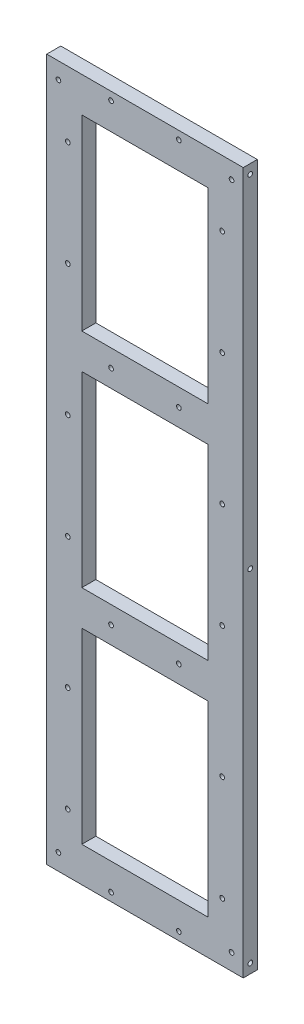
from build123d import *

# Parameters (mm, degrees)
SKETCH1_W           = 84
SKETCH1_H           = 300
SKETCH1_W_2         = 54
SKETCH1_H_2         = 80
BOSS_EXTRUDE1_DEPTH = 6
SKETCH2_R           = 1
CUT_EXTRUDE1_DEPTH  = 10
SKETCH4_R           = 1
CUT_EXTRUDE3_DEPTH  = 10
SKETCH5_R           = 1
CUT_EXTRUDE4_DEPTH  = 10


with BuildPart() as part:
    # Sketch1 → Boss-Extrude1 (new body)
    with BuildSketch(Plane.XY):
        Rectangle(SKETCH1_W, SKETCH1_H)
        with Locations((0, 95)):
            Rectangle(SKETCH1_W_2, SKETCH1_H_2, mode=Mode.SUBTRACT)
        with Locations((0, -95)):
            Rectangle(SKETCH1_W_2, SKETCH1_H_2, mode=Mode.SUBTRACT)
        Rectangle(SKETCH1_W_2, SKETCH1_H_2, mode=Mode.SUBTRACT)
    extrude(amount=BOSS_EXTRUDE1_DEPTH)

    # Sketch2 → Cut-Extrude1 (cut)
    with BuildSketch(Plane(origin=(42, 0, 0), x_dir=(0, 0, -1), z_dir=(1, 0, 0))):
        with Locations((-3, 146)):
            Circle(SKETCH2_R)
        with Locations((-3, 0)):
            Circle(SKETCH2_R)
        with Locations((-3, -146)):
            Circle(SKETCH2_R)
        with Locations((-3, -292)):
            Circle(SKETCH2_R)
    cut_extrude1 = extrude(amount=-CUT_EXTRUDE1_DEPTH, mode=Mode.SUBTRACT)

    # Mirror1: Cut-Extrude1 across plane
    add(cut_extrude1.mirror(Plane(origin=(0, 0, 0), x_dir=(0, 0, 1), z_dir=(1, 0, 0))), mode=Mode.SUBTRACT)

    # Sketch4 → Cut-Extrude3 (cut)
    with BuildSketch(Plane.XY.offset(6)):
        with Locations((-14.5, 146.5)):
            Circle(SKETCH4_R)
        with Locations((-33, 122)):
            Circle(SKETCH4_R)
        with Locations((-14.5, 47.5)):
            Circle(SKETCH4_R)
        with Locations((-14.5, -47.5)):
            Circle(SKETCH4_R)
        with Locations((-14.5, -146.5)):
            Circle(SKETCH4_R)
        with Locations((-33, -125)):
            Circle(SKETCH4_R)
        with Locations((-33, 77)):
            Circle(SKETCH4_R)
        with Locations((-33, -80)):
            Circle(SKETCH4_R)
        with Locations((-33, 21)):
            Circle(SKETCH4_R)
        with Locations((-33, -24)):
            Circle(SKETCH4_R)
        with Locations(Location((33, -24, 0), (0, 0, 180))):
            Circle(SKETCH4_R)
        with Locations(Location((33, 21, 0), (0, 0, 180))):
            Circle(SKETCH4_R)
        with Locations(Location((33, -80, 0), (0, 0, 180))):
            Circle(SKETCH4_R)
        with Locations(Location((33, 77, 0), (0, 0, 180))):
            Circle(SKETCH4_R)
        with Locations(Location((33, -125, 0), (0, 0, 180))):
            Circle(SKETCH4_R)
        with Locations(Location((14.5, -146.5, 0), (0, 0, 180))):
            Circle(SKETCH4_R)
        with Locations(Location((14.5, -47.5, 0), (0, 0, 180))):
            Circle(SKETCH4_R)
        with Locations(Location((14.5, 47.5, 0), (0, 0, 180))):
            Circle(SKETCH4_R)
        with Locations(Location((33, 122, 0), (0, 0, 180))):
            Circle(SKETCH4_R)
        with Locations(Location((14.5, 146.5, 0), (0, 0, 180))):
            Circle(SKETCH4_R)
    extrude(amount=-CUT_EXTRUDE3_DEPTH, mode=Mode.SUBTRACT)

    # Sketch5 → Cut-Extrude4 (cut)
    with BuildSketch(Plane.XY.offset(6)):
        with Locations((-37, -143)):
            Circle(SKETCH5_R)
        with Locations((37, -143)):
            Circle(SKETCH5_R)
        with Locations((-37, 143)):
            Circle(SKETCH5_R)
        with Locations((37, 143)):
            Circle(SKETCH5_R)
    extrude(amount=-CUT_EXTRUDE4_DEPTH, mode=Mode.SUBTRACT)


solid = part.part
